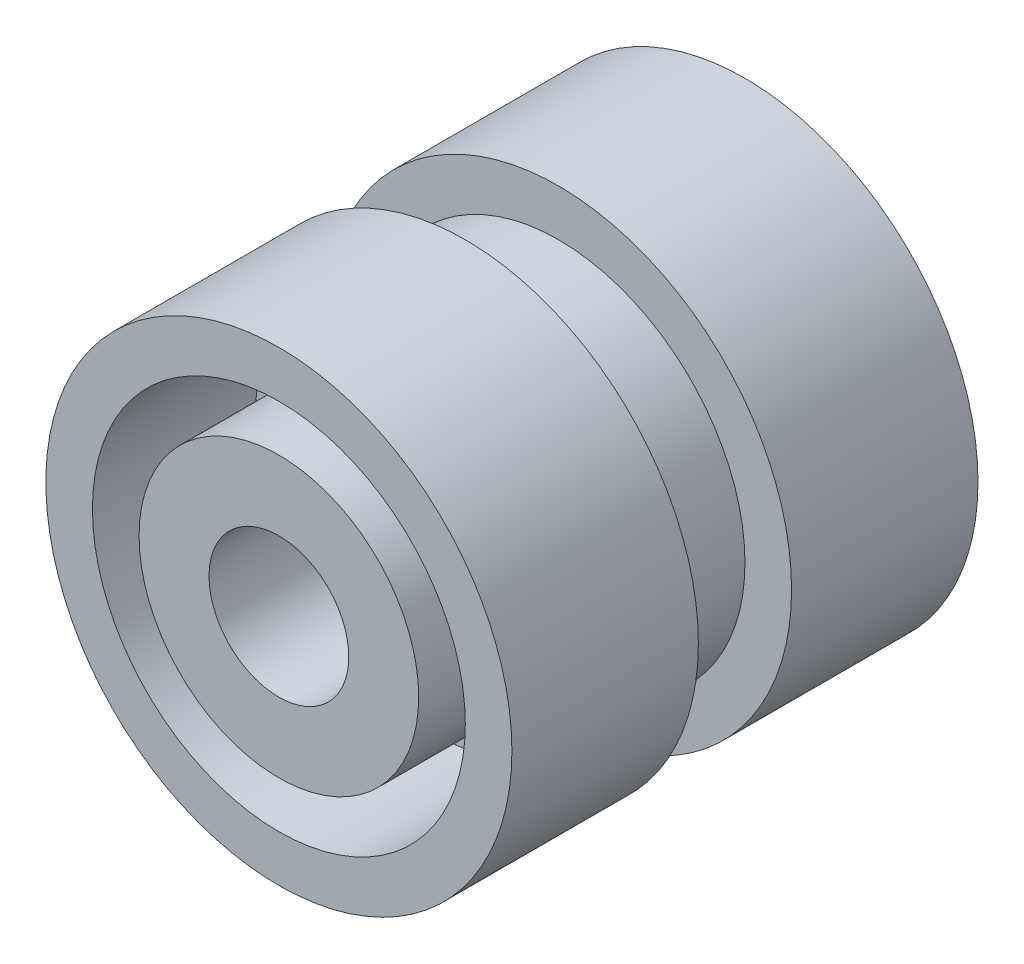
from build123d import *

# Parameters (mm, degrees)
BOSS_EXTRUDE1_START     = 2
BOSS_EXTRUDE1_DEPTH     = 2
CUT_EXTRUDE1_DEPTH      = 13.247448714
CUT_EXTRUDE1_DEPTH_BACK = 8
SKETCH4_R               = 1.5


with BuildPart() as part:
    # Sketch2 → Revolve1 (revolve)
    with BuildSketch(Plane(origin=(0, 0, 0), x_dir=(0, 0, -1), z_dir=(1, 0, 0))):
        Polygon((-5, 0), (0, 0), (1.5, 0), (1.5, 4), (5, 4), (5, 5), (1, 5), (1, 4), (-1, 4), (-1, 5), (-5, 5), (-5, 4), (-1.5, 4), (-1.5, 3), (-5, 3), align=None)
    revolve(axis=Axis((0, 0, 8.247820203), (0, 0, -1)))

    # Sketch3 → Boss-Extrude1 (add)
    with BuildSketch(Plane(origin=(0, 0, -1.5), x_dir=(-1, 0, 0), z_dir=(0, 0, -1)).offset(BOSS_EXTRUDE1_START)):
        with BuildLine():
            Line((0.5, 1.936491673), (0.5, 3.968626967))
            ThreePointArc((0.5, 3.968626967), (0, 4), (-0.5, 3.968626967))
            Line((-0.5, 3.968626967), (-0.5, 1.936491673))
            ThreePointArc((-0.5, 1.936491673), (-1.414213562, 1.414213562), (-1.936491673, 0.5))
            Line((-1.936491673, 0.5), (-3.968626967, 0.5))
            ThreePointArc((-3.968626967, 0.5), (-4, 0), (-3.968626967, -0.5))
            Line((-3.968626967, -0.5), (-1.936491673, -0.5))
            ThreePointArc((-1.936491673, -0.5), (-1.414213562, -1.414213562), (-0.5, -1.936491673))
            Line((-0.5, -1.936491673), (-0.5, -3.968626967))
            ThreePointArc((-0.5, -3.968626967), (0, -4), (0.5, -3.968626967))
            Line((0.5, -3.968626967), (0.5, -1.936491673))
            ThreePointArc((0.5, -1.936491673), (1.414213562, -1.414213562), (1.936491673, -0.5))
            Line((1.936491673, -0.5), (3.968626967, -0.5))
            ThreePointArc((3.968626967, -0.5), (4, 0), (3.968626967, 0.5))
            Line((3.968626967, 0.5), (1.936491673, 0.5))
            ThreePointArc((1.936491673, 0.5), (1.414213562, 1.414213562), (0.5, 1.936491673))
        make_face()
    extrude(amount=-BOSS_EXTRUDE1_DEPTH)

    # Sketch4 → Cut-Extrude1 (cut, two sides: drawn at the far end of the back side and taken through both)
    with BuildSketch(Plane.XY.offset(5).offset(-CUT_EXTRUDE1_DEPTH_BACK)):
        Circle(SKETCH4_R)
    extrude(amount=CUT_EXTRUDE1_DEPTH + CUT_EXTRUDE1_DEPTH_BACK, mode=Mode.SUBTRACT)


solid = part.part
